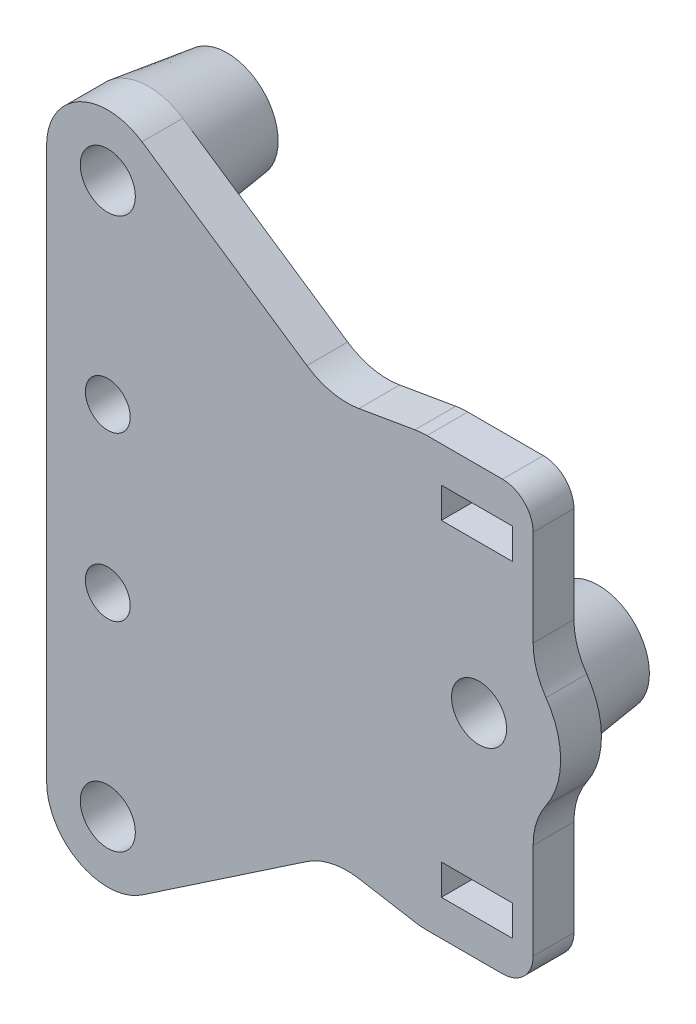
from build123d import *

# Parameters (mm, degrees)
SKETCH_1_R          = 2.2
SKETCH_1_R_2        = 2.7
EXTRUDE_1_DEPTH     = 4
CUT_EXTRUDE_1_REACH = 59.017
EXTRUDE_START       = -4
SKETCH_6_W          = 7
SKETCH_6_H          = 3
SKETCH_6_R          = 2.7
EXTRUDE_3_DEPTH     = 4
FILLET_1_R          = 7
FILLET_2_R          = 3


with BuildPart() as part:
    # 草图1 → 凸台-拉伸1 (new body)
    with BuildSketch(Plane.XY):
        with BuildLine():
            Line((-22.03836949, 31.611607058), (-45, 12.5))
            Line((-45, 12.5), (-45, -12.5))
            Line((-45, -12.5), (-22.03836949, -31.611607058))
            ThreePointArc((-22.03836949, -31.611607058), (-18.500125226, -32.992489036), (-14.841614052, -31.972046241))
            Line((-14.841614052, -31.972046241), (22.677847931, -6.629394988))
            ThreePointArc((22.677847931, -6.629394988), (26.2, 0), (22.677847931, 6.629394988))
            Line((22.677847931, 6.629394988), (-14.841614052, 31.972046241))
            ThreePointArc((-14.841614052, 31.972046241), (-18.500125226, 32.992489036), (-22.03836949, 31.611607058))
        make_face()
        with Locations((-18.2, -8)):
            Circle(SKETCH_1_R, mode=Mode.SUBTRACT)
        with Locations((-18.2, 8)):
            Circle(SKETCH_1_R, mode=Mode.SUBTRACT)
        with Locations((-34.2, 0)):
            Circle(SKETCH_1_R, mode=Mode.SUBTRACT)
        with Locations((-18.2, 27)):
            Circle(SKETCH_1_R_2, mode=Mode.SUBTRACT)
        with Locations((-18.2, -27)):
            Circle(SKETCH_1_R_2, mode=Mode.SUBTRACT)
        with Locations((18.2, 0)):
            Circle(SKETCH_1_R_2, mode=Mode.SUBTRACT)
    extrude(amount=EXTRUDE_1_DEPTH)

    # 草图4 → 旋转1 (revolve)
    with BuildSketch(Plane(origin=(-25.021499827, 16.900859193, 0), x_dir=(0, 0, -1), z_dir=(0.8286743735186554, -0.5597309913462574, 0)), mode=Mode.PRIVATE) as revolve_1_sk:
        Polygon((7.7, 17.187104043), (7.7, 14.887104043), (0, 14.887104043), (0, 18.187104043), align=None)
    revolve_1 = revolve(revolve_1_sk.sketch.rotate(Axis((-18.2, 27, 1000.278995542), (0, 0, -1)), 55.962803956), axis=Axis((-18.2, 27, 1000.278995542), (0, 0, -1)))

    # 镜向1: 旋转1 across plane
    add(revolve_1.mirror(Plane.ZX))

    # 草图5 → 切除-拉伸1 (cut, up to next)
    with BuildSketch(Plane.XY.offset(4), mode=Mode.PRIVATE) as cut_extrude_1_sk1:
        with BuildLine():
            Line((-24.2, -27), (-24.2, 27))
            ThreePointArc((-24.2, 27), (-23.632780915, 29.546545018), (-22.03836949, 31.611607058))
            Line((-22.03836949, 31.611607058), (-45, 12.5))
            Line((-45, 12.5), (-45, -12.5))
            Line((-45, -12.5), (-22.03836949, -31.611607058))
            ThreePointArc((-22.03836949, -31.611607058), (-23.632780915, -29.546545018), (-24.2, -27))
        make_face()
    cut_extrude_1_tool1 = extrude(cut_extrude_1_sk1.sketch, amount=-CUT_EXTRUDE_1_REACH, mode=Mode.PRIVATE) & part.part
    add(cut_extrude_1_tool1.solids().sort_by_distance((-33.15819, 0, 4))[0], mode=Mode.SUBTRACT)

    # 草图6 → 凸台-拉伸3 (add)
    with BuildSketch(Plane.XY.offset(4).offset(EXTRUDE_START)):
        Polygon((12.5, -13.504057816), (3.649903477, -19.481886332), (12.5, -21), (23.5, -21), (23.5, 21), (12.5, 21), (3.649903477, 19.481886332), (12.5, 13.504057816), align=None)
        with Locations((18, -16)):
            Rectangle(SKETCH_6_W, SKETCH_6_H, mode=Mode.SUBTRACT)
        with Locations((18.2, 0)):
            Circle(SKETCH_6_R, mode=Mode.SUBTRACT)
        with Locations((18, 16)):
            Rectangle(SKETCH_6_W, SKETCH_6_H, mode=Mode.SUBTRACT)
    extrude(amount=EXTRUDE_3_DEPTH)

    # 圆角1
    fillet_1_edges = [part.edges().sort_by_distance(p)[0] for p in [
        (12.5, -21, 2),
        (3.649903477, -19.481886332, 2),
        (23.5, -5.992495307, 2),
        (23.5, 5.992495307, 2),
        (12.5, 21, 2),
        (3.649903477, 19.481886332, 2),
    ]]
    fillet(fillet_1_edges, radius=FILLET_1_R)

    # 圆角2
    fillet_2_edges = [part.edges().sort_by_distance(p)[0] for p in [
        (23.5, -21, 2),
        (23.5, 21, 2),
    ]]
    fillet(fillet_2_edges, radius=FILLET_2_R)

    # 草图7 → 旋转2 (revolve)
    with BuildSketch(Plane(origin=(6.459619467, 8.708524022, 0), x_dir=(0.8031661431318494, -0.5957551061692293, 0), z_dir=(0.5957551061692293, 0.8031661431318494, 0)), mode=Mode.PRIVATE) as revolve_2_sk:
        Polygon((11.917623805, 7.7), (11.917623805, 0), (8.617623805, 0), (9.617623805, 7.7), align=None)
    revolve(revolve_2_sk.sketch.rotate(Axis((18.2, 0, 0), (0, 0, -1)), 143.433519356), axis=Axis((18.2, 0, 0), (0, 0, -1)))


solid = part.part
